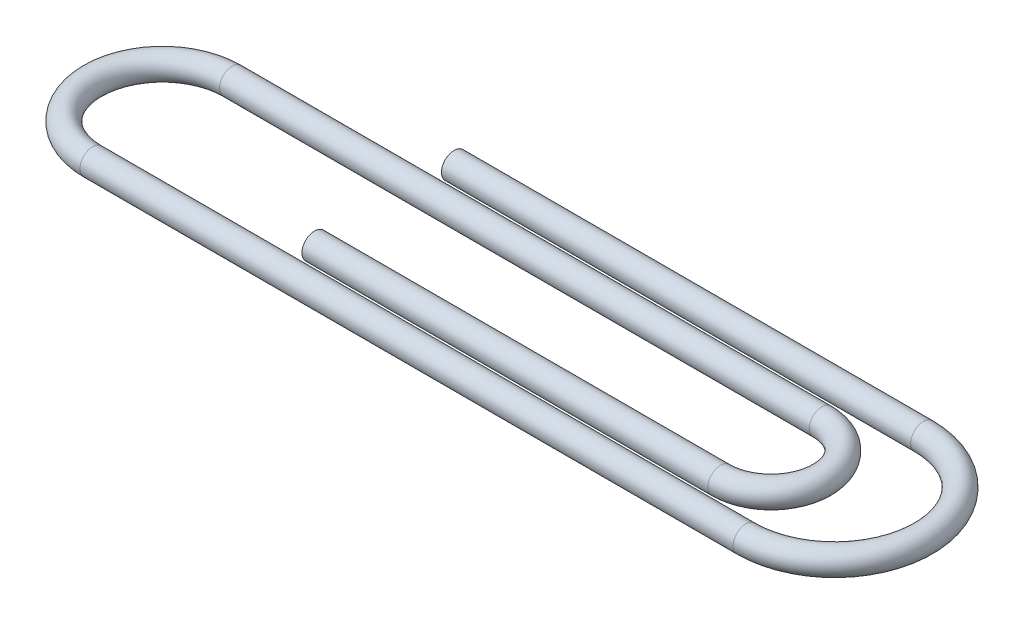
from build123d import *

# Parameters (mm, degrees)
SWEEP1_PROFILE_R = 0.5


with BuildPart() as part:
    # Sweep1: sweep along a path in Sketch1
    with BuildLine(Plane(origin=(0, 0, 0), x_dir=(1, 0, 0), z_dir=(0, 1, 0))) as sweep1_path:
        Line((0, 0), (18.5, 0))
        ThreePointArc((18.5, 0), (22, -3.5), (18.5, -7))
        Line((18.5, -7), (-7.25, -7))
        ThreePointArc((-7.25, -7), (-10, -4.25), (-7.25, -1.5))
        Line((-7.25, -1.5), (16, -1.5))
        ThreePointArc((16, -1.5), (18, -3.5), (16, -5.5))
        Line((16, -5.5), (0, -5.5))
    # Sweep1 profile (on start of the path) → Sweep1 (sweep)
    with BuildSketch(Plane(origin=(0, 0, 0), x_dir=(0, 0, 1), z_dir=(1, 0, 0))):
        Circle(SWEEP1_PROFILE_R)
    sweep(path=sweep1_path.line)


solid = part.part
